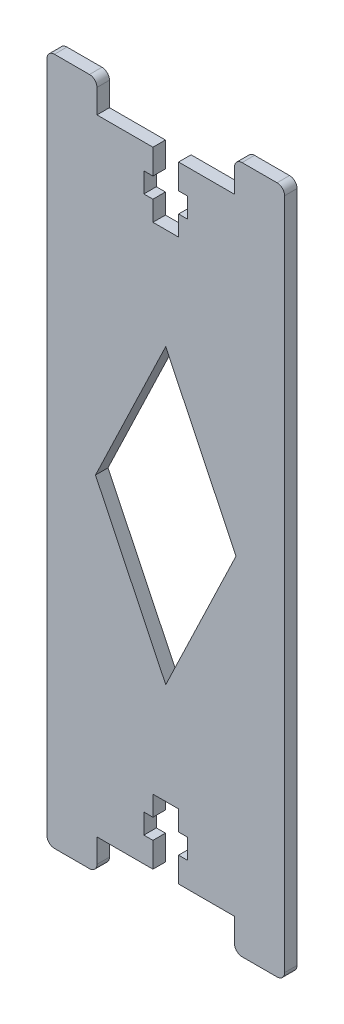
from build123d import *

# Parameters (mm, degrees)
EXTRUDE_1_DEPTH = 2
FILLET_1_R      = 1.2


with BuildPart() as part:
    # 草图1 → 凸台-拉伸1 (new body)
    with BuildSketch(Plane.XY):
        Polygon((15.059090909, 15.4), (15.059090909, -94.6), (7.059090909, -94.6), (7.059090909, -89.6), (-1.890909091, -89.6), (-1.890909091, -85.6), (-0.440909091, -85.6), (-0.440909091, -82.4), (-1.890909091, -82.4), (-1.890909091, -79.2), (-5.990909091, -79.2), (-5.990909091, -82.4), (-7.440909091, -82.4), (-7.440909091, -85.6), (-5.990909091, -85.6), (-5.990909091, -89.6), (-14.940909091, -89.6), (-14.940909091, -94.6), (-22.940909091, -94.6), (-22.940909091, 15.4), (-14.940909091, 15.4), (-14.940909091, 10.4), (-5.990909091, 10.4), (-5.990909091, 6.4), (-7.440909091, 6.4), (-7.440909091, 3.2), (-5.990909091, 3.2), (-5.990909091, 0), (-1.890909091, 0), (-1.890909091, 3.2), (-0.440909091, 3.2), (-0.440909091, 6.4), (-1.890909091, 6.4), (-1.890909091, 10.4), (7.059090909, 10.4), (7.059090909, 15.4), align=None)
        Polygon((-3.940909091, -16.181864614), (-15.17688314, -39.6), (-3.940909091, -63.018135386), (7.295064958, -39.6), align=None, mode=Mode.SUBTRACT)
    extrude(amount=EXTRUDE_1_DEPTH)

    # 圆角1
    fillet_1_edges = [part.edges().sort_by_distance(p)[0] for p in [
        (7.059090909, 15.4, 1),
        (15.059090909, 15.4, 1),
        (15.059090909, -94.6, 1),
        (7.059090909, -94.6, 1),
        (-14.940909091, -94.6, 1),
        (-22.940909091, -94.6, 1),
        (-22.940909091, 15.4, 1),
        (-14.940909091, 15.4, 1),
    ]]
    fillet(fillet_1_edges, radius=FILLET_1_R)


solid = part.part
